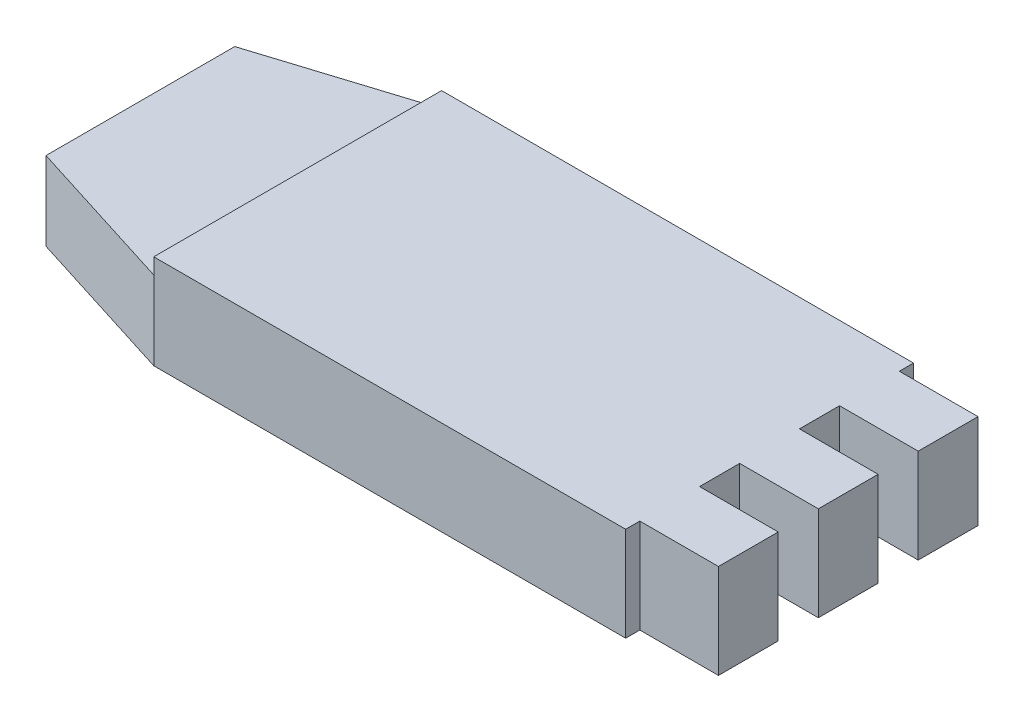
from build123d import *

# Parameters (mm, degrees)
SKETCH1_W           = 5
SKETCH1_H           = 3.8
BOSS_EXTRUDE1_DEPTH = 6
BOSS_EXTRUDE2_DEPTH = 5


with BuildPart() as part:
    # Sketch1 → Boss-Extrude1 (new body)
    with BuildSketch(Plane(origin=(0, 0, 0), x_dir=(1, 0, 0), z_dir=(0, 1, 0))):
        Polygon((12.5, 8.25), (12.5, 9.15), (-17.5, 9.15), (-17.5, -9.15), (12.5, -9.15), (12.5, -8.25), (12.5, -4.45), (12.5, -1.9), (12.5, 1.9), (12.5, 4.45), (17.5, 4.45), (17.5, 8.25), align=None)
        with Locations((15, 0)):
            Rectangle(SKETCH1_W, SKETCH1_H)
        with Locations((15, -6.35)):
            Rectangle(SKETCH1_W, SKETCH1_H)
    extrude(amount=BOSS_EXTRUDE1_DEPTH)

    # Sketch2 → Boss-Extrude2 (add)
    with BuildSketch(Plane(origin=(0, 0, 0), x_dir=(1, 0, 0), z_dir=(0, 1, 0))):
        Polygon((-17.5, 0), (-17.5, 9.15), (-27.5, 6), (-27.5, 0), align=None)
        Polygon((-17.5, -9.15), (-17.5, 0), (-27.5, 0), (-27.5, -6), align=None)
    extrude(amount=BOSS_EXTRUDE2_DEPTH)


solid = part.part
